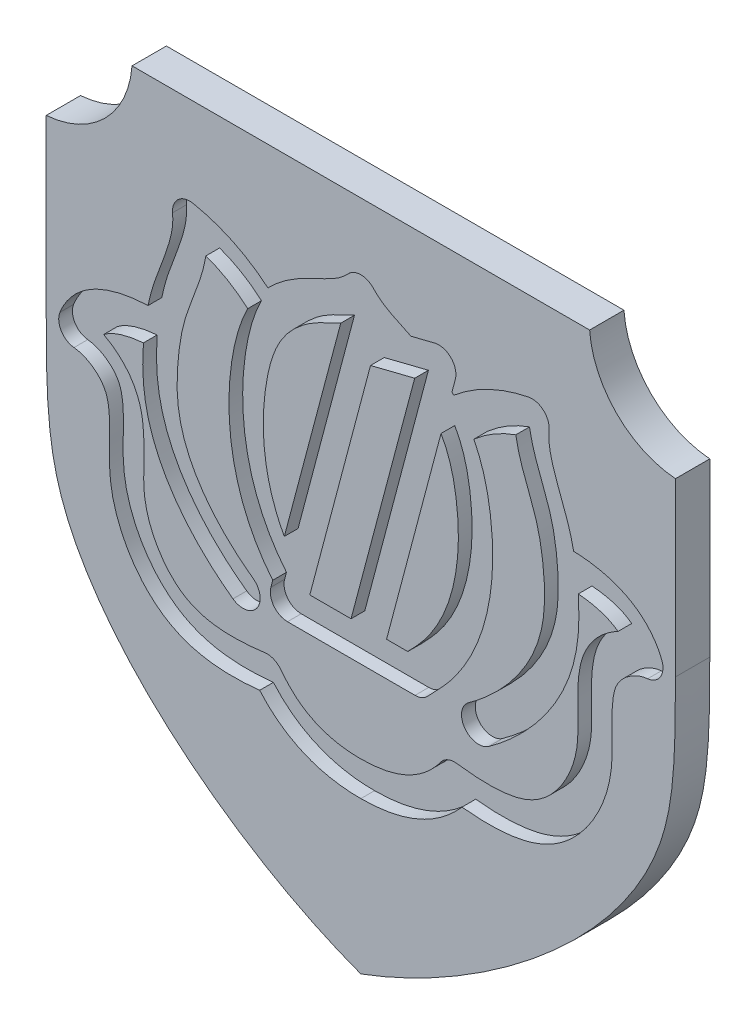
from build123d import *

# Parameters (mm, degrees)
EXTRUDE_1_DEPTH     = 2
CUT_EXTRUDE_1_DEPTH = 0.8
SKETCH_13_W         = 36.653873444
SKETCH_13_H         = 2
EXTRUDE_2_DEPTH     = 3
CUT_EXTRUDE_7_DEPTH = 73.208392134


with BuildPart() as part:
    # 草图2 → 凸台-拉伸1 (new body)
    with BuildSketch(Plane.XY):
        with BuildLine():
            Line((4.14944402, 56.541087982), (40.803317464, 56.541087982))
            Line((40.803317464, 56.541087982), (40.803317464, 44.541087982))
            add(Edge.make_bspline(
                [(40.803317464, 44.541087982), (40.803317464, 40.353473104), (40.490806088, 31.437212617), (29.583269347, 23.023001088), (22.476380742, 20.392216248)],
                knots=[0, 0, 0, 0, 0.275347051, 1, 1, 1, 1], degree=3))
            add(Edge.make_bspline(
                [(4.14944402, 44.541087982), (4.14944402, 40.353473104), (4.461955396, 31.437212617), (15.369492138, 23.023001088), (22.476380742, 20.392216248)],
                knots=[0, 0, 0, 0, 0.275347051, 1, 1, 1, 1], degree=3))
            Line((4.14944402, 44.541087982), (4.14944402, 56.541087982))
        make_face()
    extrude(amount=EXTRUDE_1_DEPTH)

    # 草图4 → 切除-拉伸1 (cut)
    with BuildSketch(Plane.XY.offset(2)):
        with BuildLine():
            Line((27.784152087, 52.397341533), (27.981831592, 53.143286622))
            ThreePointArc((27.981831592, 53.143286622), (27.726790513, 54.102042216), (26.77135867, 54.369265407))
            Line((26.77135867, 54.369265407), (25.395050453, 54.0232222))
            add(Edge.make_bspline(
                [(25.395050453, 54.0232222), (25.335846638, 54.051490037), (25.105091011, 54.160458783), (24.565553408, 54.409110616), (23.995015983, 54.702034402), (23.592453058, 54.986816769), (23.378362863, 55.172777119), (23.284982676, 55.265796198), (23.220229576, 55.335655361), (23.211451172, 55.34518477)],
                knots=[-0.034078111, -0.034078111, -0.034078111, -0.034078111, -0.024899575, 0.001910404, 0.055530361, 0.082340339, 0.095745329, 0.109150318, 0.111193208, 0.111193208, 0.111193208, 0.111193208], degree=3))
            ThreePointArc((23.211451172, 55.34518477), (22.477503581, 55.667652829), (21.742561876, 55.347456941))
            add(Edge.make_bspline(
                [(21.742561876, 55.347456941), (21.684888763, 55.285237198), (21.522365799, 55.116321374), (21.192828832, 54.857712985), (20.559534078, 54.480613027), (19.584565734, 54.055868091), (18.225502301, 53.337160929), (17.428531049, 52.670952957), (17.065981304, 52.294440264), (17.064911058, 52.293328094)],
                knots=[-0.000190615, -0.000190615, -0.000190615, -0.000190615, 0.014022294, 0.046888217, 0.079754141, 0.145485988, 0.211217835, 0.276949682, 0.277144355, 0.277144355, 0.277144355, 0.277144355], degree=3))
            add(Edge.make_bspline(
                [(17.064911058, 52.293328094), (16.413088981, 52.841728219), (15.084965863, 53.611022977), (14.00676471, 54.03950634), (13.218995365, 54.269630694), (12.788754955, 54.361558252), (12.710230547, 54.377946824)],
                knots=[0.183705798, 0.183705798, 0.183705798, 0.466542452, 0.699813679, 0.85532783, 0.971963443, 0.999219271, 0.999219271, 0.999219271], degree=2))
            ThreePointArc((12.710230547, 54.377946824), (11.840456738, 54.145464699), (11.510081982, 53.307964288))
            add(Edge.make_bspline(
                [(11.510081982, 53.307964288), (11.518630747, 53.214489437), (11.528334387, 53.069589208), (11.520797224, 52.724669766), (11.438344947, 52.104458363), (11.145342917, 51.125510903), (10.648022023, 49.888915371), (10.282824426, 48.808202575), (10.128621072, 48.150365491), (10.080539658, 47.91322629)],
                knots=[-0.000425991, -0.000425991, -0.000425991, -0.000425991, 0.015831091, 0.03251192, 0.065873578, 0.132596894, 0.19932021, 0.266043526, 0.302182628, 0.302182628, 0.302182628, 0.302182628], degree=3))
            add(Edge.make_bspline(
                [(10.080539658, 47.91322629), (10.061699939, 47.912586824), (9.718959196, 47.899999771), (9.01976931, 47.840461515), (7.99239258, 47.623325593), (6.982184058, 47.234054266), (6.044076171, 46.626530494), (5.385807388, 45.877754549), (5.075993202, 45.310911501), (4.968273515, 45.053180309), (4.950776964, 45.010260401)],
                knots=[0.142029972, 0.142029972, 0.142029972, 0.142029972, 0.150825701, 0.301651402, 0.452477103, 0.603302803, 0.754128504, 0.904954205, 0.980367056, 0.9990701, 0.9990701, 0.9990701, 0.9990701], degree=3))
            ThreePointArc((4.950776964, 45.010260401), (5.018016007, 44.120409811), (5.769143291, 43.638576889))
            add(Edge.make_bspline(
                [(5.769143291, 43.638576889), (5.778631232, 43.637549584), (5.828975975, 43.63194175), (5.921153638, 43.618491929), (6.167459192, 43.565180062), (6.642770704, 43.384294878), (7.1522801, 43.016765937), (7.501591275, 42.562691698), (7.721248764, 42.111433037), (7.853125083, 41.285306879), (7.847199747, 40.140243818), (7.8041062, 38.880571843), (7.923030172, 37.451927981), (8.350241971, 36.035170779), (9.026974821, 34.71292238), (9.94412888, 33.540178571), (11.094074405, 32.582267075), (12.467752966, 31.962002493), (13.871906766, 31.691435606), (15.274898018, 31.64539175), (16.143383259, 31.709391458), (16.583743887, 31.755772174)],
                knots=[7.3206e-05, 7.3206e-05, 7.3206e-05, 7.3206e-05, 0.001867888, 0.010010289, 0.026295093, 0.058864699, 0.124003913, 0.156573519, 0.189143126, 0.254282339, 0.319421552, 0.384560765, 0.449699979, 0.514839192, 0.579978405, 0.645117618, 0.710256831, 0.775396045, 0.840535258, 0.905674471, 0.970813684, 0.970813684, 0.970813684, 0.970813684], degree=3))
            add(Edge.make_bspline(
                [(16.583743887, 31.755772174), (17.398549708, 30.814246832), (19.154002609, 29.819950698), (21.128753172, 29.235432187), (22.476380742, 29.238996135)],
                knots=[0.081569354, 0.081569354, 0.081569354, 0.425980846, 0.655588508, 1, 1, 1], degree=2))
            add(Edge.make_bspline(
                [(22.476380742, 29.238996135), (23.824008312, 29.235432187), (25.798758875, 29.819950698), (27.554211776, 30.814246832), (28.369017597, 31.755772174)],
                knots=[0.081569354, 0.081569354, 0.081569354, 0.425980846, 0.655588508, 1, 1, 1], degree=2))
            add(Edge.make_bspline(
                [(28.369017597, 31.755772174), (28.809378225, 31.709391458), (29.677863466, 31.64539175), (31.080854718, 31.691435606), (32.485008518, 31.962002493), (33.858687079, 32.582267075), (35.008632604, 33.540178571), (35.925786663, 34.71292238), (36.602519513, 36.035170779), (37.029731312, 37.451927981), (37.148655284, 38.880571843), (37.105561737, 40.140243818), (37.099636401, 41.285306879), (37.23151272, 42.111433037), (37.451170209, 42.562691698), (37.800481384, 43.016765937), (38.30999078, 43.384294878), (38.785302292, 43.565180062), (39.031607846, 43.618491929), (39.123785509, 43.63194175), (39.174130252, 43.637549584), (39.183618193, 43.638576889)],
                knots=[-0.071413727, -0.071413727, -0.071413727, -0.071413727, -0.006274514, 0.058864699, 0.124003913, 0.189143126, 0.254282339, 0.319421552, 0.384560765, 0.449699979, 0.514839192, 0.579978405, 0.645117618, 0.710256831, 0.742826438, 0.775396045, 0.840535258, 0.873104864, 0.889389668, 0.897532069, 0.899326751, 0.899326751, 0.899326751, 0.899326751], degree=3))
            ThreePointArc((39.183618193, 43.638576889), (39.934745477, 44.120409811), (40.00198452, 45.010260401))
            add(Edge.make_bspline(
                [(40.00198452, 45.010260401), (39.984487969, 45.053180309), (39.876768282, 45.310911501), (39.566954096, 45.877754549), (38.908685313, 46.626530495), (37.970577426, 47.234054266), (36.960368904, 47.623325593), (35.932992174, 47.840461515), (35.233802288, 47.899999771), (34.891061545, 47.912586824), (34.872221825, 47.91322629)],
                knots=[0.207535507, 0.207535507, 0.207535507, 0.207535507, 0.226238551, 0.301651402, 0.452477103, 0.603302803, 0.754128504, 0.904954205, 1.055779906, 1.064575635, 1.064575635, 1.064575635, 1.064575635], degree=3))
            add(Edge.make_bspline(
                [(33.442679501, 53.307964289), (33.434130736, 53.214489437), (33.424427097, 53.069589208), (33.431964259, 52.724669767), (33.514416536, 52.104458364), (33.807418566, 51.125510903), (34.30473946, 49.888915371), (34.669937058, 48.808202576), (34.824140412, 48.150365491), (34.872221825, 47.91322629)],
                knots=[-0.000425991, -0.000425991, -0.000425991, -0.000425991, 0.015831091, 0.03251192, 0.065873578, 0.132596894, 0.19932021, 0.266043526, 0.302182628, 0.302182628, 0.302182628, 0.302182628], degree=3))
            ThreePointArc((33.442679501, 53.307964289), (33.112304744, 54.1454647), (32.242530935, 54.377946824))
            add(Edge.make_bspline(
                [(27.887263378, 52.292834148), (28.539344741, 52.841538364), (29.867795621, 53.611022975), (30.945996773, 54.039506339), (31.733766117, 54.269630694), (32.164006527, 54.361558253), (32.242530935, 54.377946824)],
                knots=[0.18357843, 0.18357843, 0.18357843, 0.466542452, 0.699813679, 0.85532783, 0.971963443, 0.999219271, 0.999219271, 0.999219271], degree=2))
            add(Edge.make_bspline(
                [(27.784152087, 52.397341533), (27.818857521, 52.362858396), (27.853233027, 52.32801928), (27.887263378, 52.292834148)],
                knots=[0.270816566, 0.270816566, 0.270816566, 0.270816566, 0.276986197, 0.276986197, 0.276986197, 0.276986197], degree=3))
        make_face()
        with BuildLine():
            Line((22.676004261, 36.025469981), (23.445517091, 36.025469981))
            Line((23.445517091, 36.025470022), (25.633563077, 36.025470022))
            ThreePointArc((25.633563077, 36.025470022), (26.015598362, 36.101322284), (26.339677165, 36.317371939))
            add(Edge.make_bspline(
                [(27.240165768, 37.267304321), (26.887491477, 36.885195281), (26.476847569, 36.45420938), (26.351640339, 36.329301594), (26.339677165, 36.317371939)],
                knots=[0, 0, 0, 0.579983142, 0.966638571, 1.007901982, 1.007901982, 1.007901982], degree=2))
            add(Edge.make_bspline(
                [(29.061004793, 50.663976103), (29.311787618, 50.176528278), (29.761710613, 48.97667206), (30.098883185, 47.076505998), (30.242394862, 44.283164489), (29.770175135, 41.4989482), (28.589174406, 38.958390663), (27.724440088, 37.791929819), (27.240165768, 37.267304321)],
                knots=[0.362176621, 0.362176621, 0.362176621, 0.362176621, 0.432514554, 0.527095462, 0.621676369, 0.810838185, 0.905419092, 1, 1, 1, 1], degree=3))
            add(Edge.make_bspline(
                [(29.061004793, 50.663976103), (30.161136853, 51.625733082), (31.502320949, 52.103614176)],
                knots=[0.152942448, 0.152942448, 0.152942448, 0.755868788, 0.755868788, 0.755868788], degree=2))
            add(Edge.make_bspline(
                [(31.502320949, 52.103614176), (31.573357013, 51.659657242), (31.814029987, 50.766345086), (32.263466026, 49.597718659), (32.647401326, 48.586278366), (32.891287404, 47.686345413), (33.066193481, 46.66912162), (33.185859027, 45.435041646), (33.187170773, 44.151323696), (32.960043537, 42.589672401), (32.233089267, 40.825320936), (30.881841719, 39.012636236), (29.636737789, 37.873918319), (28.938614759, 37.347203473), (28.758175121, 37.217725392)],
                knots=[0.057103966, 0.057103966, 0.057103966, 0.057103966, 0.116034968, 0.17496597, 0.233896972, 0.292827974, 0.351758977, 0.410689979, 0.469620981, 0.528551983, 0.646413987, 0.764275991, 0.882137996, 0.924114362, 0.924114362, 0.924114362, 0.924114362], degree=3))
            ThreePointArc((28.758175126, 37.217725385), (28.758122645, 37.217687735), (28.758070167, 37.217650081))
            ThreePointArc((28.758070167, 37.217650081), (28.528554193, 35.822236299), (29.923953148, 35.592630197))
            add(Edge.make_bspline(
                [(35.141483326, 45.89605249), (35.143884909, 45.862440194), (35.18264031, 45.296332308), (35.20674844, 44.125007334), (34.958707376, 42.408486827), (34.245459367, 40.343727293), (33.118445941, 38.589144309), (31.808855423, 37.1550886), (30.833934141, 36.276980886), (30.208295011, 35.796605597), (29.923953148, 35.592630197)],
                knots=[0.395260525, 0.395260525, 0.395260525, 0.395260525, 0.399490157, 0.466213473, 0.532936789, 0.599660105, 0.733106737, 0.799830052, 0.866553368, 0.924130229, 0.924130229, 0.924130229, 0.924130229], degree=3))
            add(Edge.make_bspline(
                [(37.456499425, 45.161963344), (37.248761764, 45.319604473), (36.806735833, 45.560992958), (35.985893105, 45.801596825), (35.405596366, 45.875921232), (35.141483326, 45.89605249)],
                knots=[0, 0, 0, 0, 0.179181539, 0.358363078, 0.510398935, 0.510398935, 0.510398935, 0.510398935], degree=3))
            add(Edge.make_bspline(
                [(28.064000405, 33.805678889), (28.230616322, 33.784409524), (28.756644462, 33.720485105), (29.998114107, 33.626325282), (31.744295553, 33.752747319), (33.307139976, 34.566446844), (34.364482325, 35.945479111), (34.890316401, 37.230313827), (35.174084715, 38.504730088), (35.097131642, 39.9074168), (35.110631927, 41.552452753), (35.298470605, 42.728393083), (35.773509967, 43.676216978), (36.405007476, 44.473166663), (37.014064275, 44.930745021), (37.456499425, 45.161963344)],
                knots=[0.096660994, 0.096660994, 0.096660994, 0.096660994, 0.124704003, 0.185200356, 0.306193062, 0.427185768, 0.548178474, 0.608674827, 0.66917118, 0.790163886, 0.850660239, 0.911156592, 0.941404768, 0.971652944, 1.032149297, 1.032149297, 1.032149297, 1.032149297], degree=3))
            ThreePointArc((28.064000405, 33.805678889), (27.547619196, 33.734647671), (27.137132121, 33.413407344))
            add(Edge.make_bspline(
                [(22.476380742, 31.238996135), (23.772512734, 31.244881848), (25.418236669, 31.851197767), (26.380672479, 32.544287512), (26.899719765, 33.107851038), (27.08665997, 33.346054831), (27.137132121, 33.413407344)],
                knots=[-0.091281266, -0.091281266, -0.091281266, 0.317949209, 0.590769525, 0.795384763, 0.880641112, 0.908409563, 0.908409563, 0.908409563], degree=2))
            add(Edge.make_bspline(
                [(17.815629363, 33.413407342), (17.866101513, 33.346054829), (18.053041719, 33.107851036), (18.572089005, 32.54428751), (19.534524815, 31.851197765), (21.18024875, 31.244881848), (22.476380742, 31.238996135)],
                knots=[0.000309171, 0.000309171, 0.000309171, 0.028077623, 0.113333972, 0.317949209, 0.590769525, 1, 1, 1], degree=2))
            ThreePointArc((17.815629363, 33.413407342), (17.405142287, 33.734647669), (16.888761079, 33.805678887))
            add(Edge.make_bspline(
                [(7.496262059, 45.161963342), (7.938697209, 44.930745018), (8.547754008, 44.473166661), (9.179251517, 43.676216976), (9.654290879, 42.728393081), (9.842129557, 41.552452751), (9.855629842, 39.907416797), (9.778676769, 38.504730086), (10.062445083, 37.230313824), (10.588279159, 35.945479109), (11.645621508, 34.566446842), (13.208465931, 33.752747317), (14.954647377, 33.626325279), (16.196117022, 33.720485103), (16.722145162, 33.784409522), (16.888761079, 33.805678887)],
                knots=[0.06420765, 0.06420765, 0.06420765, 0.06420765, 0.124704003, 0.15495218, 0.185200356, 0.245696709, 0.306193062, 0.427185768, 0.487682121, 0.548178474, 0.66917118, 0.790163886, 0.911156592, 0.971652944, 0.999695953, 0.999695953, 0.999695953, 0.999695953], degree=3))
            add(Edge.make_bspline(
                [(9.811278157, 45.896052488), (9.547165118, 45.87592123), (8.966868379, 45.801596823), (8.146025651, 45.560992955), (7.70399972, 45.319604471), (7.496262059, 45.161963342)],
                knots=[0.206327221, 0.206327221, 0.206327221, 0.206327221, 0.358363078, 0.537544617, 0.716726156, 0.716726156, 0.716726156, 0.716726156], degree=3))
            add(Edge.make_bspline(
                [(9.811278157, 45.896052488), (9.808876574, 45.862440192), (9.770121174, 45.296332307), (9.746013044, 44.125007333), (9.994054108, 42.408486826), (10.707302117, 40.343727293), (11.834315544, 38.589144308), (13.143906061, 37.155088599), (14.118827343, 36.276980886), (14.744466473, 35.796605597), (15.028808336, 35.592630197)],
                knots=[0.395260526, 0.395260526, 0.395260526, 0.395260526, 0.399490157, 0.466213473, 0.532936789, 0.599660105, 0.733106737, 0.799830052, 0.866553368, 0.924130229, 0.924130229, 0.924130229, 0.924130229], degree=3))
            ThreePointArc((15.028808336, 35.592630197), (16.424244941, 35.82228878), (16.194586358, 37.217725385))
            add(Edge.make_bspline(
                [(13.45044053, 52.103614169), (13.379404466, 51.659657235), (13.138731492, 50.766345079), (12.689295454, 49.597718651), (12.305360153, 48.586278359), (12.061474075, 47.686345406), (11.886567998, 46.669121613), (11.766902452, 45.435041639), (11.765590706, 44.151323688), (11.992717943, 42.589672394), (12.719672213, 40.825320928), (14.070919761, 39.012636228), (15.316023691, 37.873918312), (16.01414672, 37.347203465), (16.194586358, 37.217725385)],
                knots=[0.057103966, 0.057103966, 0.057103966, 0.057103966, 0.116034968, 0.17496597, 0.233896972, 0.292827974, 0.351758977, 0.410689979, 0.469620981, 0.528551983, 0.646413987, 0.764275991, 0.882137996, 0.924114362, 0.924114362, 0.924114362, 0.924114362], degree=3))
            add(Edge.make_bspline(
                [(15.891040238, 50.664602355), (14.791187926, 51.625888676), (13.45044053, 52.103614169)],
                knots=[0.153138765, 0.153138765, 0.153138765, 0.755868788, 0.755868788, 0.755868788], degree=2))
            add(Edge.make_bspline(
                [(15.891040238, 50.664602355), (15.491520559, 49.891563404), (14.959047442, 48.088050864), (14.702714405, 45.342816251), (14.979576081, 42.426580546), (15.762305435, 40.118000353), (16.655432911, 38.581818133), (17.145068952, 37.930501885), (17.344786139, 37.688643973)],
                knots=[0.362153063, 0.362153063, 0.362153063, 0.362153063, 0.474145223, 0.605608917, 0.737072612, 0.868536306, 0.934268153, 0.975477332, 0.975477332, 0.975477332, 0.975477332], degree=3))
            Line((17.344786139, 37.688643973), (17.236926053, 37.281633125))
            ThreePointArc((17.236926053, 37.281633125), (17.41104364, 36.415618829), (18.203559616, 36.025469981))
            Line((18.203559616, 36.025469981), (22.676004261, 36.025469981))
        make_face(mode=Mode.SUBTRACT)
        with BuildLine():
            Line((21.306611036, 52.638620219), (18.019709105, 40.235470896))
            add(Edge.make_bspline(
                [(21.306611036, 52.638620219), (21.298242144, 52.634494883), (20.902616139, 52.439937191), (20.15276201, 52.111567033), (19.256116474, 51.591541935), (18.448157966, 50.894981934), (17.830541249, 50.105228604), (17.240642014, 48.882266733), (16.838719256, 47.003631943), (16.73750126, 44.675326941), (17.067646297, 42.432494932), (17.6064729, 40.996793572), (17.986863979, 40.294462944), (18.019709105, 40.235470896)],
                knots=[0.097335313, 0.097335313, 0.097335313, 0.097335313, 0.098632732, 0.158723883, 0.218815034, 0.278906186, 0.338997337, 0.399088488, 0.51927079, 0.639453093, 0.759635395, 0.879817698, 0.890911867, 0.890911867, 0.890911867, 0.890911867], degree=3))
        make_face(mode=Mode.SUBTRACT)
        Polygon((25.614069302, 52.016042164), (21.906491582, 38.02546998), (19.503083241, 38.02546998), (23.039090265, 51.368618864), align=None, mode=Mode.SUBTRACT)
        with BuildLine():
            Line((25.211428556, 38.025470005), (23.975527974, 38.025470005))
            Line((23.975527974, 38.025470005), (27.1473048, 49.994193538))
            add(Edge.make_bspline(
                [(27.1473048, 49.994193538), (27.394809186, 49.574327433), (27.789571496, 48.599424282), (28.108142063, 46.845093363), (28.230356387, 44.413604097), (27.82365497, 42.059010713), (26.854851424, 39.982375546), (26.160915273, 39.046746475), (25.770565418, 38.623871503)],
                knots=[0.345263489, 0.345263489, 0.345263489, 0.345263489, 0.432514554, 0.527095462, 0.621676369, 0.810838185, 0.905419092, 1, 1, 1, 1], degree=3))
            add(Edge.make_bspline(
                [(25.770565418, 38.623871503), (25.436566168, 38.262071505), (25.211428556, 38.025470005)],
                knots=[0, 0, 0, 0.558170559, 0.558170559, 0.558170559], degree=2))
        make_face(mode=Mode.SUBTRACT)
    extrude(amount=-CUT_EXTRUDE_1_DEPTH, mode=Mode.SUBTRACT)

    # 草图13 → 凸台-拉伸2 (add)
    with BuildSketch(Plane(origin=(0, 56.541087982, 0), x_dir=(1, 0, 0), z_dir=(0, 1, 0))):
        with Locations((22.476380742, -1)):
            Rectangle(SKETCH_13_W, SKETCH_13_H)
    extrude(amount=EXTRUDE_2_DEPTH)

    # 草图14 → 切除-拉伸7 (cut, through all)
    with BuildSketch(Plane.XY.offset(2)):
        with BuildLine():
            Line((9.14944402, 59.541087982), (4.14944402, 59.541087982))
            Line((4.14944402, 59.541087982), (4.14944402, 54.541087982))
            ThreePointArc((4.14944402, 54.541087982), (7.576692959, 56.113839043), (9.14944402, 59.541087982))
        make_face()
        with BuildLine():
            Line((40.803317464, 59.541087982), (40.803317464, 54.541087982))
            ThreePointArc((40.803317464, 54.541087982), (37.376068525, 56.113839043), (35.803317464, 59.541087982))
            Line((35.803317464, 59.541087982), (40.803317464, 59.541087982))
        make_face()
    extrude(amount=-CUT_EXTRUDE_7_DEPTH, mode=Mode.SUBTRACT)


solid = part.part
